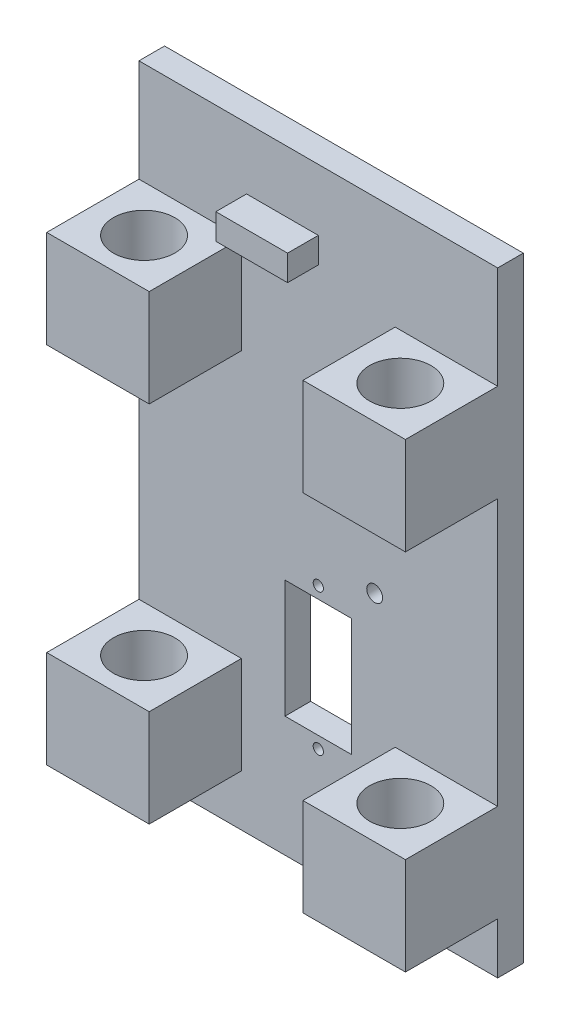
from build123d import *

# Parameters (mm, degrees)
SKETCH1_W           = 70
SKETCH1_H           = 120
BOSS_EXTRUDE1_DEPTH = 5
SKETCH2_W           = 20
SKETCH2_H           = 19
BOSS_EXTRUDE2_DEPTH = 18
SKETCH3_R           = 6
CUT_EXTRUDE1_DEPTH  = 109.415865998
CUT_EXTRUDE2_REACH  = 75.171
SKETCH4_R           = 1
SKETCH4_W           = 13
SKETCH4_H           = 23
SKETCH5_W           = 14
SKETCH5_H           = 5
BOSS_EXTRUDE3_DEPTH = 6
SKETCH6_R           = 1.55
CUT_EXTRUDE3_DEPTH  = 74.17103252


with BuildPart() as part:
    # Sketch1 → Boss-Extrude1 (new body)
    with BuildSketch(Plane.XY):
        Rectangle(SKETCH1_W, SKETCH1_H)
    extrude(amount=BOSS_EXTRUDE1_DEPTH)

    # Sketch2 → Boss-Extrude2 (add)
    with BuildSketch(Plane.XY.offset(5)):
        with Locations((-25, 30.5)):
            Rectangle(SKETCH2_W, SKETCH2_H)
        with Locations((25, 30.5)):
            Rectangle(SKETCH2_W, SKETCH2_H)
        with Locations((-25, -40.5)):
            Rectangle(SKETCH2_W, SKETCH2_H)
        with Locations((25, -40.5)):
            Rectangle(SKETCH2_W, SKETCH2_H)
    extrude(amount=BOSS_EXTRUDE2_DEPTH)

    # Sketch3 → Cut-Extrude1 (cut, through all)
    with BuildSketch(Plane(origin=(0, 40, 0), x_dir=(1, 0, 0), z_dir=(0, 1, 0))):
        with Locations(Location((-25, -14, 0), (0, 0, 180))):
            Circle(SKETCH3_R)
        with Locations(Location((25, -14, 0), (0, 0, 180))):
            Circle(SKETCH3_R)
    extrude(amount=-CUT_EXTRUDE1_DEPTH, mode=Mode.SUBTRACT)

    # Sketch4 → Cut-Extrude2 (cut, up to next)
    with BuildSketch(Plane(origin=(0, 0, 0), x_dir=(-1, 0, 0), z_dir=(0, 0, -1)), mode=Mode.PRIVATE) as cut_extrude2_sk1:
        with Locations((0, -11.2)):
            Circle(SKETCH4_R)
    cut_extrude2_tool1 = extrude(cut_extrude2_sk1.sketch, amount=-CUT_EXTRUDE2_REACH, mode=Mode.PRIVATE) & part.part
    # Sketch4 → Cut-Extrude2 (cut, up to next)
    with BuildSketch(Plane(origin=(0, 0, 0), x_dir=(-1, 0, 0), z_dir=(0, 0, -1)), mode=Mode.PRIVATE) as cut_extrude2_sk2:
        with Locations((0, -38.8)):
            Circle(SKETCH4_R)
    cut_extrude2_tool2 = extrude(cut_extrude2_sk2.sketch, amount=-CUT_EXTRUDE2_REACH, mode=Mode.PRIVATE) & part.part
    # Sketch4 → Cut-Extrude2 (cut, up to next)
    with BuildSketch(Plane(origin=(0, 0, 0), x_dir=(-1, 0, 0), z_dir=(0, 0, -1)), mode=Mode.PRIVATE) as cut_extrude2_sk3:
        with Locations((0, -25)):
            Rectangle(SKETCH4_W, SKETCH4_H)
    cut_extrude2_tool3 = extrude(cut_extrude2_sk3.sketch, amount=-CUT_EXTRUDE2_REACH, mode=Mode.PRIVATE) & part.part
    add(cut_extrude2_tool1.solids().sort_by_distance((0, -11.2, 0))[0], mode=Mode.SUBTRACT)
    add(cut_extrude2_tool2.solids().sort_by_distance((0, -38.8, 0))[0], mode=Mode.SUBTRACT)
    add(cut_extrude2_tool3.solids().sort_by_distance((0, -25, 0))[0], mode=Mode.SUBTRACT)

    # Sketch5 → Boss-Extrude3 (add)
    with BuildSketch(Plane.XY.offset(5)):
        with Locations((-7, 45.5)):
            Rectangle(SKETCH5_W, SKETCH5_H)
    extrude(amount=BOSS_EXTRUDE3_DEPTH)

    # Sketch6 → Cut-Extrude3 (cut, through all)
    with BuildSketch(Plane(origin=(0, 0, 0), x_dir=(-1, 0, 0), z_dir=(0, 0, -1))):
        with Locations((-11, -7)):
            Circle(SKETCH6_R)
        with Locations((-11, -43)):
            Circle(SKETCH6_R)
    extrude(amount=-CUT_EXTRUDE3_DEPTH, mode=Mode.SUBTRACT)


solid = part.part
